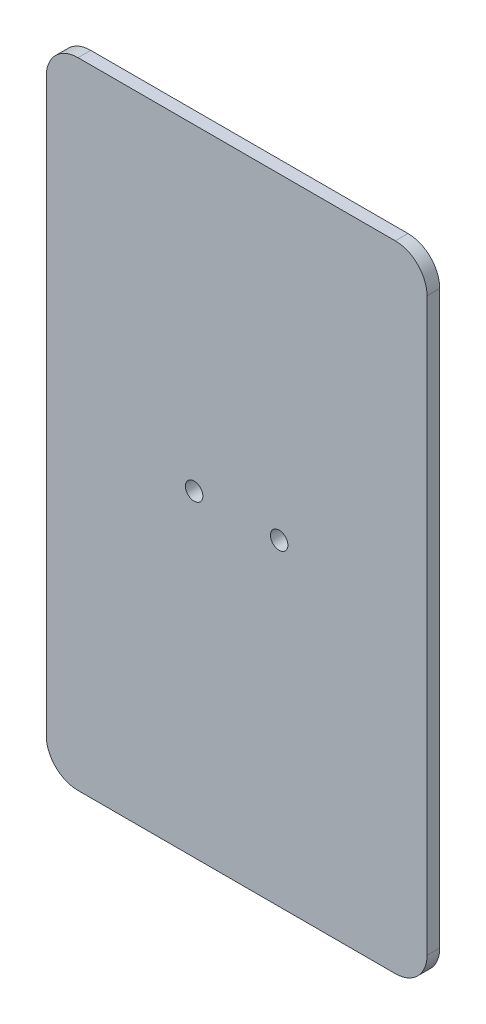
from build123d import *

# Parameters (mm, degrees)
SKETCH1_R           = 1.74625
BOSS_EXTRUDE1_DEPTH = 2.54


with BuildPart() as part:
    # Sketch1 → Boss-Extrude1 (new body)
    with BuildSketch(Plane.XY):
        with BuildLine():
            Line((6.35, 0), (69.85, 0))
            ThreePointArc((69.85, 0), (74.340128061, 1.859871939), (76.2, 6.35))
            Line((76.2, 6.35), (76.2, 120.65))
            ThreePointArc((76.2, 120.65), (74.340128061, 125.140128061), (69.85, 127))
            Line((69.85, 127), (6.35, 127))
            ThreePointArc((6.35, 127), (1.859871939, 125.140128061), (0, 120.65))
            Line((0, 120.65), (0, 6.35))
            ThreePointArc((0, 6.35), (1.859871939, 1.859871939), (6.35, 0))
        make_face()
        with Locations((29.591, 63.5)):
            Circle(SKETCH1_R, mode=Mode.SUBTRACT)
        with Locations((46.609, 63.5)):
            Circle(SKETCH1_R, mode=Mode.SUBTRACT)
    extrude(amount=BOSS_EXTRUDE1_DEPTH)


solid = part.part
